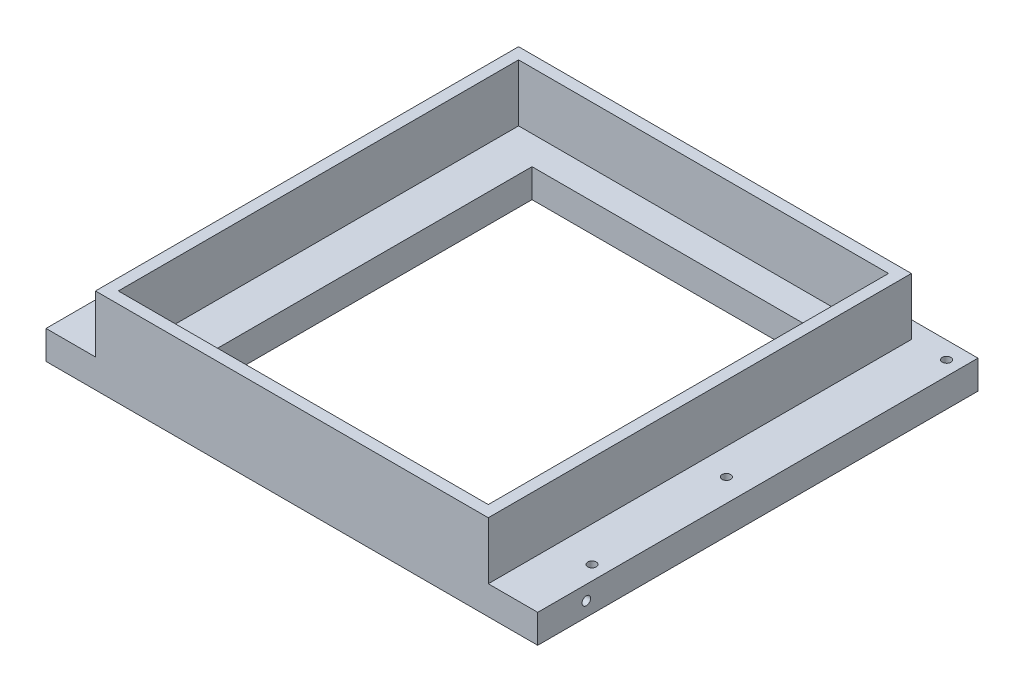
from build123d import *

# Parameters (mm, degrees)
SKETCH_1_W          = 86
SKETCH_1_H          = 174
SKETCH_1_W_2        = 50
SKETCH_1_H_2        = 25
SKETCH_1_H_3        = 55
SKETCH_1_W_3        = 76
SKETCH_1_H_4        = 43
EXTRUDE_1_DEPTH     = 5
SKETCH_4_W          = 68.7
SKETCH_4_H          = 115
SKETCH_4_W_2        = 64.7
SKETCH_4_H_2        = 37
SKETCH_4_H_3        = 70
EXTRUDE_2_DEPTH     = 10
SKETCH_5_R          = 0.75
CUT_EXTRUDE_1_DEPTH = 122.783619588
SKETCH_7_W          = 15
SKETCH_7_H          = 8
SKETCH_7_W_2        = 26
SKETCH_7_W_3        = 5
SKETCH_7_H_2        = 10
SKETCH_7_H_3        = 12.119700025
SKETCH_7_W_4        = 6
SKETCH_7_H_4        = 5
SKETCH_7_W_5        = 7
SKETCH_7_H_5        = 21
CUT_EXTRUDE_2_DEPTH = 2
SKETCH_8_R          = 0.75
CUT_EXTRUDE_3_DEPTH = 2
CUT_EXTRUDE_START   = -84
SKETCH_8_3_R        = 0.75
CUT_EXTRUDE_4_DEPTH = 2
SKETCH_9_R          = 0.75
SKETCH_9_W          = 50
SKETCH_9_H          = 25
SKETCH_9_W_2        = 76
SKETCH_9_H_2        = 43
CUT_EXTRUDE_5_DEPTH = 123.295748086


with BuildPart() as part:
    # 草图1 → 凸台-拉伸1 (new body)
    with BuildSketch(Plane(origin=(0, 0, 0), x_dir=(1, 0, 0), z_dir=(0, 1, 0))):
        with Locations((0, -26.5)):
            Rectangle(SKETCH_1_W, SKETCH_1_H)
        with Locations((0, -38)):
            Rectangle(SKETCH_1_W_2, SKETCH_1_H_2, mode=Mode.SUBTRACT)
        with Locations((0, 23)):
            Rectangle(SKETCH_1_W_2, SKETCH_1_H_3, mode=Mode.SUBTRACT)
        with Locations((0, -87)):
            Rectangle(SKETCH_1_W_3, SKETCH_1_H_4, mode=Mode.SUBTRACT)
    extrude(amount=EXTRUDE_1_DEPTH)

    # 草图4 → 凸台-拉伸2 (add)
    with BuildSketch(Plane(origin=(0, 5, 0), x_dir=(1, 0, 0), z_dir=(0, 1, 0))):
        Rectangle(SKETCH_4_W, SKETCH_4_H)
        with Locations((0, -37)):
            Rectangle(SKETCH_4_W_2, SKETCH_4_H_2, mode=Mode.SUBTRACT)
        with Locations((0, 20.5)):
            Rectangle(SKETCH_4_W_2, SKETCH_4_H_3, mode=Mode.SUBTRACT)
    extrude(amount=EXTRUDE_2_DEPTH)

    # 草图5 → 切除-拉伸1 (cut, through all)
    with BuildSketch(Plane(origin=(0, 5, 0), x_dir=(1, 0, 0), z_dir=(0, 1, 0))):
        with Locations(Location((-39, 20.5, 0), (0, 0, 270))):
            Circle(SKETCH_5_R)
        with Locations(Location((39, 20.5, 0), (0, 0, 270))):
            Circle(SKETCH_5_R)
        with Locations(Location((-39, -32.5, 0), (0, 0, 270))):
            Circle(SKETCH_5_R)
        with Locations(Location((39, -32.5, 0), (0, 0, 270))):
            Circle(SKETCH_5_R)
        with Locations(Location((-40.1427775, -60.35, 0), (0, 0, 270))):
            Circle(SKETCH_5_R)
        with Locations(Location((40.1427775, -60.35, 0), (0, 0, 270))):
            Circle(SKETCH_5_R)
        with Locations(Location((-40.1427775, -110.530299975, 0), (0, 0, 270))):
            Circle(SKETCH_5_R)
        with Locations(Location((40.1427775, -110.530299975, 0), (0, 0, 270))):
            Circle(SKETCH_5_R)
        with Locations(Location((-40.5, 57.5, 0), (0, 0, 270))):
            Circle(SKETCH_5_R)
        with Locations(Location((-40.5, -38, 0), (0, 0, 270))):
            Circle(SKETCH_5_R)
        with Locations(Location((-40.5, -85.5, 0), (0, 0, 270))):
            Circle(SKETCH_5_R)
        with Locations(Location((40.5, 57.5, 0), (0, 0, 270))):
            Circle(SKETCH_5_R)
        with Locations(Location((40.5, -38, 0), (0, 0, 270))):
            Circle(SKETCH_5_R)
        with Locations(Location((40.5, -85.5, 0), (0, 0, 270))):
            Circle(SKETCH_5_R)
        with Locations(Location((-40.5, -4.5, 0), (0, 0, 270))):
            Circle(SKETCH_5_R)
        with Locations(Location((40.5, -4.5, 0), (0, 0, 270))):
            Circle(SKETCH_5_R)
    extrude(amount=-CUT_EXTRUDE_1_DEPTH, mode=Mode.SUBTRACT)

    # 草图7 → 切除-拉伸2 (cut)
    with BuildSketch(Plane(origin=(0, 5, 0), x_dir=(1, 0, 0), z_dir=(0, 1, 0))):
        with Locations((-24.5, -61.5)):
            Rectangle(SKETCH_7_W, SKETCH_7_H)
        with Locations((0, -61.5)):
            Rectangle(SKETCH_7_W_2, SKETCH_7_H)
        with Locations((-40.5, -78.5)):
            Rectangle(SKETCH_7_W_3, SKETCH_7_H_2)
        with Locations((-40.5, -101.440149988)):
            Rectangle(SKETCH_7_W_3, SKETCH_7_H_3)
        with Locations((-32, -111)):
            Rectangle(SKETCH_7_W_4, SKETCH_7_H_4)
        with Locations((-3, -111)):
            Rectangle(SKETCH_7_W_4, SKETCH_7_H_4)
        with Locations((17.5, -111)):
            Rectangle(SKETCH_7_W_5, SKETCH_7_H_4)
        with Locations((30.5, -111)):
            Rectangle(SKETCH_7_W_5, SKETCH_7_H_4)
        with Locations((40.5, -92)):
            Rectangle(SKETCH_7_W_3, SKETCH_7_H_5)
    extrude(amount=-CUT_EXTRUDE_2_DEPTH, mode=Mode.SUBTRACT)

    # 草图8 → 切除-拉伸3 (cut)
    with BuildSketch(Plane.ZY.offset(43)):
        with Locations((8, 2.5)):
            Circle(SKETCH_8_R)
        with Locations((23, 2.5)):
            Circle(SKETCH_8_R)
        with Locations((52, 2.5)):
            Circle(SKETCH_8_R)
        with Locations((63, 2.5)):
            Circle(SKETCH_8_R)
    extrude(amount=-CUT_EXTRUDE_3_DEPTH, mode=Mode.SUBTRACT)

    # 草图8<3> → 切除-拉伸4 (cut)
    with BuildSketch(Plane.ZY.offset(43).offset(CUT_EXTRUDE_START)):
        with Locations((8, 2.5)):
            Circle(SKETCH_8_3_R)
        with Locations((23, 2.5)):
            Circle(SKETCH_8_3_R)
        with Locations((52, 2.5)):
            Circle(SKETCH_8_3_R)
        with Locations((63, 2.5)):
            Circle(SKETCH_8_3_R)
    extrude(amount=-CUT_EXTRUDE_4_DEPTH, mode=Mode.SUBTRACT)

    # 草图9 → 切除-拉伸5 (cut, through all)
    with BuildSketch(Plane(origin=(0, 0, 0), x_dir=(1, 0, 0), z_dir=(0, 1, 0))):
        Polygon((0, -16.5), (-43, -16.5), (-43, -113.5), (43, -113.5), (43, -16.5), align=None)
        with Locations((-40.5, -38)):
            Circle(SKETCH_9_R, mode=Mode.SUBTRACT)
        with Locations((-39, -32.5)):
            Circle(SKETCH_9_R, mode=Mode.SUBTRACT)
        with Locations((0, -38)):
            Rectangle(SKETCH_9_W, SKETCH_9_H, mode=Mode.SUBTRACT)
        with Locations((40.5, -38)):
            Circle(SKETCH_9_R, mode=Mode.SUBTRACT)
        with Locations((39, -32.5)):
            Circle(SKETCH_9_R, mode=Mode.SUBTRACT)
        with Locations((40.1427775, -60.35)):
            Circle(SKETCH_9_R, mode=Mode.SUBTRACT)
        with Locations((-40.1427775, -110.530299975)):
            Circle(SKETCH_9_R, mode=Mode.SUBTRACT)
        with Locations((-40.5, -85.5)):
            Circle(SKETCH_9_R, mode=Mode.SUBTRACT)
        with Locations((0, -87)):
            Rectangle(SKETCH_9_W_2, SKETCH_9_H_2, mode=Mode.SUBTRACT)
        with Locations((-40.1427775, -60.35)):
            Circle(SKETCH_9_R, mode=Mode.SUBTRACT)
        with Locations((40.1427775, -110.530299975)):
            Circle(SKETCH_9_R, mode=Mode.SUBTRACT)
        with Locations((40.5, -85.5)):
            Circle(SKETCH_9_R, mode=Mode.SUBTRACT)
    extrude(amount=CUT_EXTRUDE_5_DEPTH, mode=Mode.SUBTRACT)


solid = part.part
